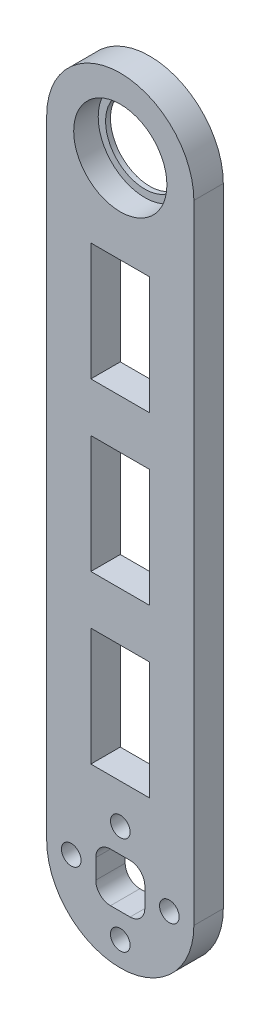
from build123d import *

# Parameters (mm, degrees)
SKETCH_1_R          = 9.5
SKETCH_1_R_2        = 2
EXTRUDE_1_DEPTH     = 6
SKETCH_2_W          = 12
SKETCH_2_H          = 24
SKETCH_2_W_2        = 10
SKETCH_2_H_2        = 10
CUT_EXTRUDE_1_DEPTH = 6
FILLET_1_R          = 3
SKETCH_3_R          = 9.5
SKETCH_3_R_2        = 8
EXTRUDE_3_DEPTH     = 1


with BuildPart() as part:
    # 草图1 → 凸台-拉伸1 (new body)
    with BuildSketch(Plane.XY):
        with BuildLine():
            Line((-15, -64), (-15, 64))
            ThreePointArc((-15, 64), (0, 79), (15, 64))
            Line((15, 64), (15, -64))
            ThreePointArc((15, -64), (0, -79), (-15, -64))
        make_face()
        with Locations((0, 64)):
            Circle(SKETCH_1_R, mode=Mode.SUBTRACT)
        with Locations((0, -54)):
            Circle(SKETCH_1_R_2, mode=Mode.SUBTRACT)
        with Locations((10, -64)):
            Circle(SKETCH_1_R_2, mode=Mode.SUBTRACT)
        with Locations((0, -74)):
            Circle(SKETCH_1_R_2, mode=Mode.SUBTRACT)
        with Locations((-10, -64)):
            Circle(SKETCH_1_R_2, mode=Mode.SUBTRACT)
    extrude(amount=EXTRUDE_1_DEPTH)

    # 草图2 → 切除-拉伸1 (cut)
    with BuildSketch(Plane.XY.offset(6)):
        with Locations((0, 34)):
            Rectangle(SKETCH_2_W, SKETCH_2_H)
        Rectangle(SKETCH_2_W, SKETCH_2_H)
        with Locations((0, -34)):
            Rectangle(SKETCH_2_W, SKETCH_2_H)
        with Locations((0, -64)):
            Rectangle(SKETCH_2_W_2, SKETCH_2_H_2)
    extrude(amount=-CUT_EXTRUDE_1_DEPTH, mode=Mode.SUBTRACT)

    # 圆角1
    fillet_1_edges = [part.edges().sort_by_distance(p)[0] for p in [
        (5, -59, 3),
        (5, -69, 3),
        (-5, -69, 3),
        (-5, -59, 3),
    ]]
    fillet(fillet_1_edges, radius=FILLET_1_R)

    # 草图3 → 凸台-拉伸3 (add)
    with BuildSketch(Plane(origin=(0, 0, 0), x_dir=(-1, 0, 0), z_dir=(0, 0, -1))):
        with Locations((0, 64)):
            Circle(SKETCH_3_R)
        with Locations((0, 64)):
            Circle(SKETCH_3_R_2, mode=Mode.SUBTRACT)
    extrude(amount=-EXTRUDE_3_DEPTH)


solid = part.part
